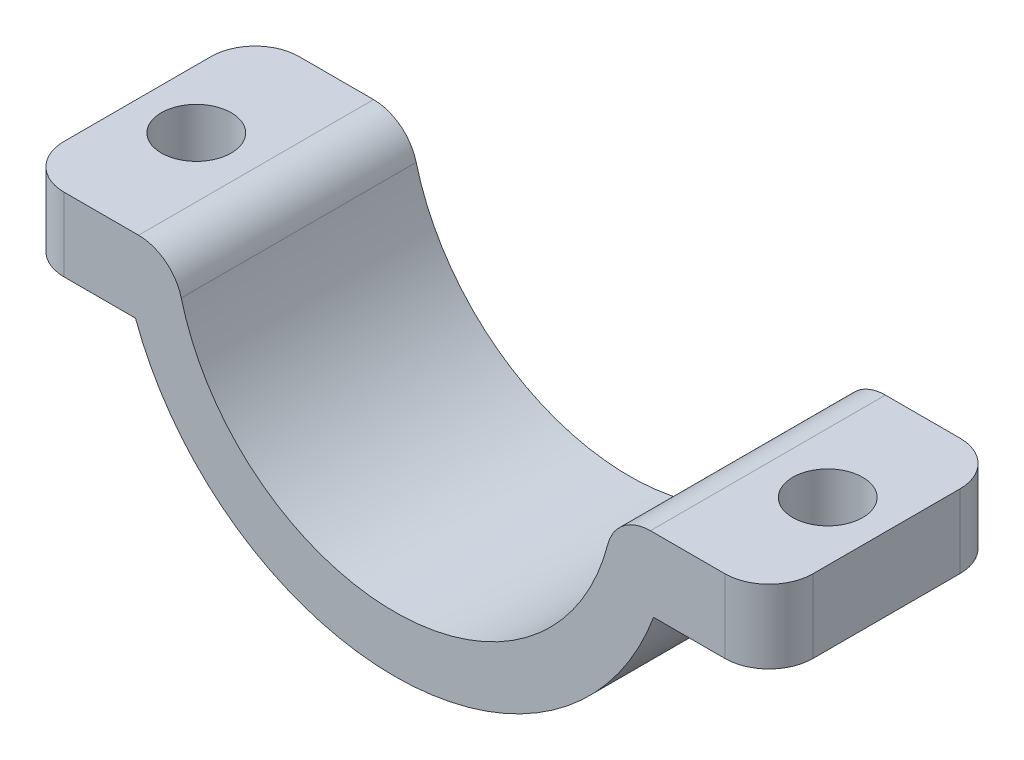
from build123d import *

# Parameters (mm, degrees)
SALIENTE_EXTRUIR1_DEPTH = 8
CROQUIS2_R              = 2.38125
CORTAR_EXTRUIR1_DEPTH   = 16
REDONDEO1_R             = 3


with BuildPart() as part:
    # Croquis1 → Saliente-Extruir1 (new, symmetric)
    with BuildSketch(Plane.XY):
        with BuildLine():
            Line((25.5, -1.5), (18.740064034, -1.5))
            ThreePointArc((18.740064034, -1.5), (18.361312119, -4.037600434), (17.640578222, -6.5))
            Line((17.640578222, -6.5), (25.5, -6.5))
            Line((25.5, -6.5), (25.5, -1.5))
        make_face()
        with BuildLine():
            Line((18.740064034, -1.5), (14.924811557, -1.5))
            ThreePointArc((14.924811557, -1.5), (14.43972216, -4.06133278), (13.518505835, -6.5))
            Line((13.518505835, -6.5), (17.640578222, -6.5))
            ThreePointArc((17.640578222, -6.5), (18.361312119, -4.037600434), (18.740064034, -1.5))
        make_face()
        with BuildLine():
            ThreePointArc((13.518505835, -6.5), (0, -15), (-13.518505835, -6.5))
            Line((-13.518505835, -6.5), (-17.640578222, -6.5))
            ThreePointArc((-17.640578222, -6.5), (0, -18.8), (17.640578222, -6.5))
            Line((17.640578222, -6.5), (13.518505835, -6.5))
        make_face()
        with BuildLine():
            ThreePointArc((-13.518505835, -6.5), (-14.43972216, -4.06133278), (-14.924811557, -1.5))
            Line((-14.924811557, -1.5), (-18.740064034, -1.5))
            ThreePointArc((-18.740064034, -1.5), (-18.361312119, -4.037600434), (-17.640578222, -6.5))
            Line((-17.640578222, -6.5), (-13.518505835, -6.5))
        make_face()
        with BuildLine():
            ThreePointArc((-17.640578222, -6.5), (-18.361312119, -4.037600434), (-18.740064034, -1.5))
            Line((-18.740064034, -1.5), (-25.5, -1.5))
            Line((-25.5, -1.5), (-25.5, -6.5))
            Line((-25.5, -6.5), (-17.640578222, -6.5))
        make_face()
    extrude(amount=SALIENTE_EXTRUIR1_DEPTH, both=True)

    # Croquis2 → Cortar-Extruir1 (cut)
    with BuildSketch(Plane(origin=(0, -1.5, 0), x_dir=(1, 0, 0), z_dir=(0, 1, 0))):
        with Locations(Location((-21.5, 0, 0), (0, 0, 180))):
            Circle(CROQUIS2_R)
        with Locations(Location((21.5, 0, 0), (0, 0, 180))):
            Circle(CROQUIS2_R)
    extrude(amount=-CORTAR_EXTRUIR1_DEPTH, mode=Mode.SUBTRACT)

    # Redondeo1
    redondeo1_edges = [part.edges().sort_by_distance(p)[0] for p in [
        (25.5, -4, -8),
        (-25.5, -4, -8),
        (-14.924811557, -1.5, 0),
        (14.924811557, -1.5, 0),
        (-25.5, -4, 8),
        (25.5, -4, 8),
    ]]
    fillet(redondeo1_edges, radius=REDONDEO1_R)


solid = part.part
